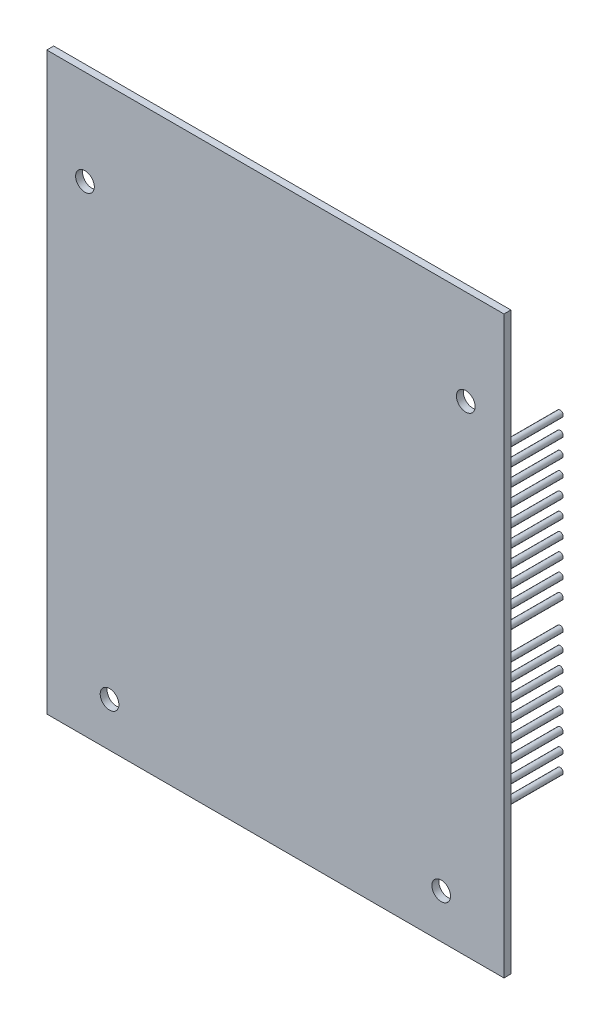
from build123d import *

# Parameters (mm, degrees)
CROQUIS1_W                     = 66.04
CROQUIS1_H                     = 83.058
SALIENTE_EXTRUIR1_DEPTH        = 1
TALADRO_DE_MARGEN_PARA_M2_51_D = 2.7
CROQUIS9_R                     = 0.45
SALIENTE_EXTRUIR2_DEPTH        = 17


with BuildPart() as part:
    # Croquis1 → Saliente-Extruir1 (new body)
    with BuildSketch(Plane.XY):
        with Locations((33.02, 41.529)):
            Rectangle(CROQUIS1_W, CROQUIS1_H)
    extrude(amount=SALIENTE_EXTRUIR1_DEPTH)

    # Taladro de margen para M2.51 (through all)
    with Locations(Plane(origin=(5.51942, 69.37502, 1), x_dir=(1, 0, 0), z_dir=(0, 0, 1))):
        with Locations((0, 0), (55.00116, 0), (3.54838, -63.00216), (51.45278, -63.00216)):
            Hole(TALADRO_DE_MARGEN_PARA_M2_51_D / 2)

    # Croquis9 → Saliente-Extruir2 (add)
    with BuildSketch(Plane.XY.offset(1)):
        with Locations((57.15, 57.658)):
            Circle(CROQUIS9_R)
        with Locations((57.15, 55.118)):
            Circle(CROQUIS9_R)
        with Locations((57.15, 52.578)):
            Circle(CROQUIS9_R)
        with Locations((57.15, 50.038)):
            Circle(CROQUIS9_R)
        with Locations((57.15, 44.958)):
            Circle(CROQUIS9_R)
        with Locations((57.15, 39.878)):
            Circle(CROQUIS9_R)
        with Locations((57.15, 37.338)):
            Circle(CROQUIS9_R)
        with Locations((57.15, 47.498)):
            Circle(CROQUIS9_R)
        with Locations((57.15, 42.418)):
            Circle(CROQUIS9_R)
        with Locations((57.15, 34.798)):
            Circle(CROQUIS9_R)
        with Locations((57.15, 30.734)):
            Circle(CROQUIS9_R)
        with Locations((57.15, 28.194)):
            Circle(CROQUIS9_R)
        with Locations((57.15, 25.654)):
            Circle(CROQUIS9_R)
        with Locations((57.15, 20.574)):
            Circle(CROQUIS9_R)
        with Locations((57.15, 23.114)):
            Circle(CROQUIS9_R)
        with Locations((57.15, 15.494)):
            Circle(CROQUIS9_R)
        with Locations((57.15, 18.034)):
            Circle(CROQUIS9_R)
        with Locations((8.89, 23.114)):
            Circle(CROQUIS9_R)
        with Locations((8.89, 20.574)):
            Circle(CROQUIS9_R)
        with Locations((8.89, 18.034)):
            Circle(CROQUIS9_R)
        with Locations((8.89, 15.494)):
            Circle(CROQUIS9_R)
        with Locations((8.89, 30.734)):
            Circle(CROQUIS9_R)
        with Locations((57.15, 12.954)):
            Circle(CROQUIS9_R)
        with Locations((8.89, 25.654)):
            Circle(CROQUIS9_R)
        with Locations((8.89, 12.954)):
            Circle(CROQUIS9_R)
        with Locations((8.89, 48.514)):
            Circle(CROQUIS9_R)
        with Locations((8.89, 45.974)):
            Circle(CROQUIS9_R)
        with Locations((8.89, 43.434)):
            Circle(CROQUIS9_R)
        with Locations((8.89, 38.354)):
            Circle(CROQUIS9_R)
        with Locations((8.89, 40.894)):
            Circle(CROQUIS9_R)
        with Locations((8.89, 33.274)):
            Circle(CROQUIS9_R)
        with Locations((8.89, 35.814)):
            Circle(CROQUIS9_R)
    extrude(amount=-SALIENTE_EXTRUIR2_DEPTH)


solid = part.part
